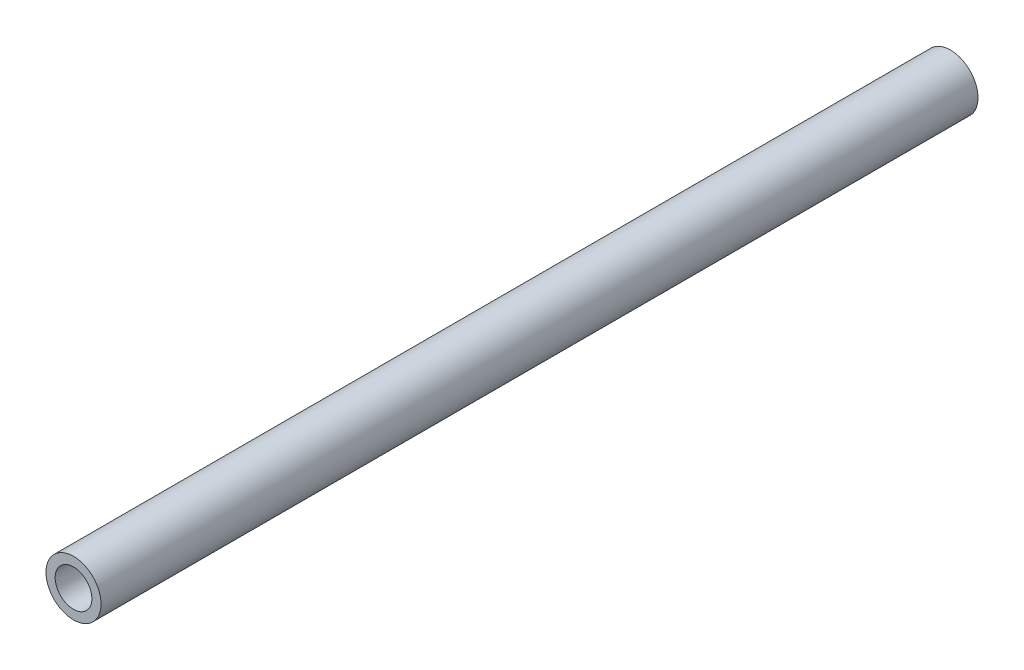
from build123d import *

# Parameters (mm, degrees)
MAIN_PROFILE_SKETCH_R   = 3
MAIN_PROFILE_SKETCH_R_2 = 2
MAIN_EXTRUSION_DEPTH    = 95.5


with BuildPart() as part:
    # Main Profile Sketch → Main Extrusion (new body)
    with BuildSketch(Plane.XY.offset(44.5)):
        with Locations((-255, 51.5)):
            Circle(MAIN_PROFILE_SKETCH_R)
        with Locations((-255, 51.5)):
            Circle(MAIN_PROFILE_SKETCH_R_2, mode=Mode.SUBTRACT)
    extrude(amount=-MAIN_EXTRUSION_DEPTH)


solid = part.part
